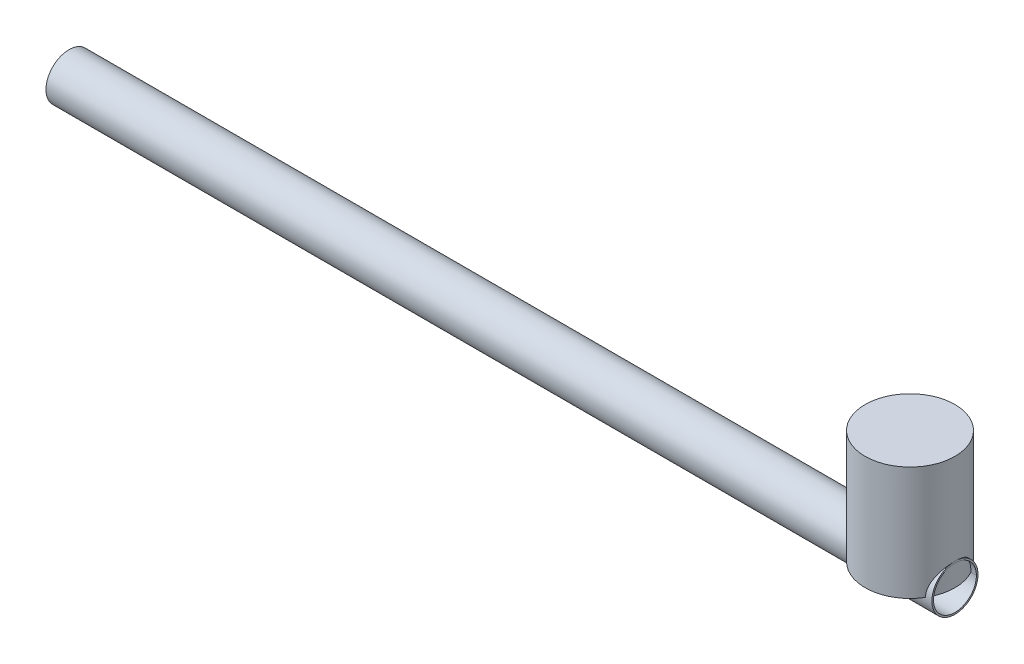
from build123d import *
from build123d.topology import SkipClean

# Parameters (mm, degrees)
SKETCH1_R           = 12.7
SKETCH1_R_2         = 11.811
BOSS_EXTRUDE1_DEPTH = 488.039
SKETCH2_R           = 24.73915762
BOSS_EXTRUDE2_DEPTH = 62.7


with BuildPart() as part:
    # Sketch1 → Boss-Extrude1 (new body)
    with BuildSketch(Plane(origin=(0, 0, 0), x_dir=(0, 0, -1), z_dir=(1, 0, 0))):
        Circle(SKETCH1_R)
        Circle(SKETCH1_R_2, mode=Mode.SUBTRACT)
    extrude(amount=BOSS_EXTRUDE1_DEPTH)

    # Sketch2 → Boss-Extrude2 (add)
    with SkipClean():  # the faces are left unmerged after this step: merging them gives an invalid solid
        with BuildSketch(Plane(origin=(0, 0, 0), x_dir=(1, 0, 0), z_dir=(0, 1, 0))):
            with Locations(Location((463.29984238, 0, 0), (0, 0, 30.887644414))):
                Circle(SKETCH2_R)
        extrude(amount=BOSS_EXTRUDE2_DEPTH)


solid = part.part
